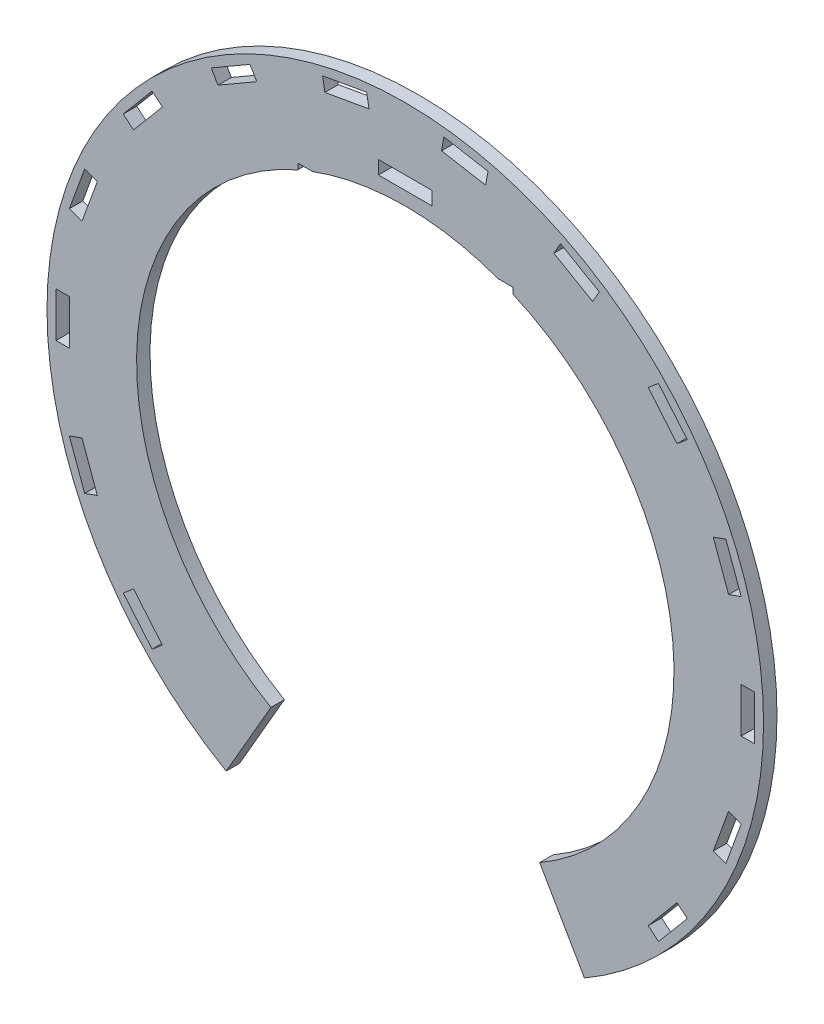
from build123d import *

# Parameters (mm, degrees)
P_IDAT_VYSUNUT_M1_DEPTH  = 3
SKICA3_W                 = 12
SKICA3_H                 = 3
SKICA3_W_2               = 3
SKICA3_H_2               = 10
ODEBRAT_VYSUNUT_M1_DEPTH = 3
SKICA4_W                 = 48
SKICA4_H                 = 3.5
ODEBRAT_VYSUNUT_M3_DEPTH = 3


with BuildPart() as part:
    # Skica1 → Přidat vysunutím1 (new body)
    with BuildSketch(Plane.XY):
        with BuildLine():
            Line((-40, -69.282032303), (-30, -51.961524227))
            ThreePointArc((-30, -51.961524227), (0, 60), (30, -51.961524227))
            Line((30, -51.961524227), (40, -69.282032303))
            ThreePointArc((40, -69.282032303), (0, 80), (-40, -69.282032303))
        make_face()
    extrude(amount=P_IDAT_VYSUNUT_M1_DEPTH)

    # Skica3 → Odebrat vysunutím1 (cut)
    with BuildSketch(Plane.XY.offset(3)):
        Polygon((-43.330127019, 65.049981495), (-34.669872981, 70.049981495), (-33.169872981, 67.451905284), (-41.830127019, 62.451905284), align=None)
        with Locations((0, 64.5)):
            Rectangle(SKICA3_W, SKICA3_H)
        Polygon((-18.468596623, 75.946763847), (-8.620519093, 77.683245623), (-8.09957456, 74.728822364), (-17.94765209, 72.992340588), align=None)
        Polygon((8.620519093, 77.683245623), (18.468596623, 75.946763847), (17.94765209, 72.992340588), (8.09957456, 74.728822364), align=None)
        Polygon((34.669872981, 70.049981495), (43.330127019, 65.049981495), (41.830127019, 62.451905284), (33.169872981, 67.451905284), align=None)
        Polygon((56.537528515, 53.967655771), (62.965404612, 46.30721134), (60.667271282, 44.378848511), (54.239395185, 52.039292942), align=None)
        Polygon((71.585923705, 31.376034283), (75.006125138, 21.979108075), (72.187047276, 20.953047646), (68.766845842, 30.349973853), align=None)
        with Locations((76.5, 0)):
            Rectangle(SKICA3_W_2, SKICA3_H_2)
        Polygon((75.006125138, -21.979108075), (71.585923705, -31.376034283), (68.766845842, -30.349973853), (72.187047276, -20.953047645), align=None)
        Polygon((62.965404612, -46.30721134), (56.537528515, -53.967655771), (54.239395186, -52.039292942), (60.667271282, -44.378848511), align=None)
        Polygon((-56.537528515, -53.967655771), (-62.965404612, -46.30721134), (-60.667271282, -44.378848511), (-54.239395185, -52.039292942), align=None)
        Polygon((-71.585923705, -31.376034283), (-75.006125138, -21.979108075), (-72.187047276, -20.953047645), (-68.766845842, -30.349973853), align=None)
        with Locations((-76.5, 0)):
            Rectangle(SKICA3_W_2, SKICA3_H_2)
        Polygon((-75.006125138, 21.979108075), (-71.585923705, 31.376034283), (-68.766845842, 30.349973853), (-72.187047276, 20.953047645), align=None)
        Polygon((-62.965404612, 46.30721134), (-56.537528515, 53.967655771), (-54.239395185, 52.039292942), (-60.667271282, 44.378848511), align=None)
    extrude(amount=-ODEBRAT_VYSUNUT_M1_DEPTH, mode=Mode.SUBTRACT)

    # Skica4 → Odebrat vysunutím3 (cut)
    with BuildSketch(Plane(origin=(0, 0, 0), x_dir=(-1, 0, 0), z_dir=(0, 0, -1))):
        with Locations((0, 54.56)):
            Rectangle(SKICA4_W, SKICA4_H)
    extrude(amount=-ODEBRAT_VYSUNUT_M3_DEPTH, mode=Mode.SUBTRACT)


solid = part.part
